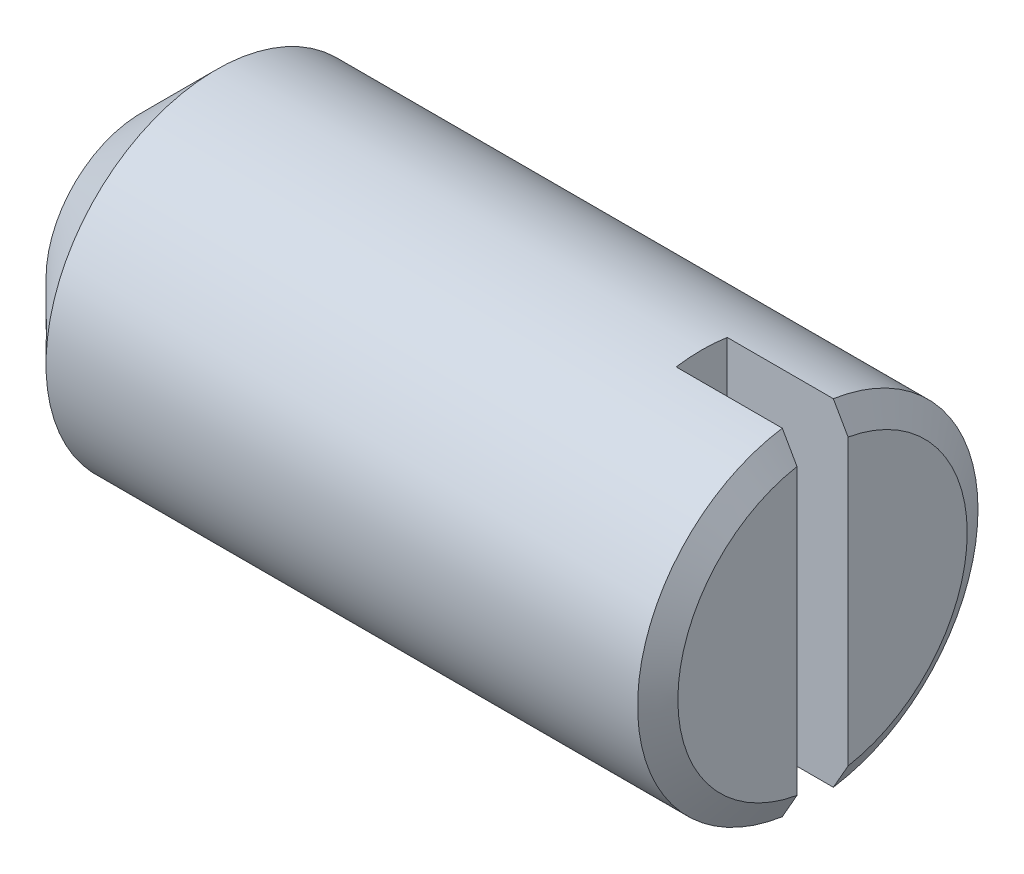
from build123d import *

# Parameters (mm, degrees)
SKICA2_W                 = 0.6
SKICA2_H                 = 4
ODEBRAT_VYSUNUT_M1_DEPTH = 1.42


with BuildPart() as part:
    # Skica1 → Otočit kolem osy1 (revolve)
    with BuildSketch(Plane(origin=(0, 0, 0), x_dir=(1, 0, 0), z_dir=(0, 1, 0))):
        Polygon((0, 0), (0, 1.125), (0.875, 2), (7.826794919, 2), (8, 1.7), (8, 0), align=None)
    revolve(axis=Axis((8, 0, 0), (-1, 0, 0)))

    # Skica2 → Odebrat vysunutím1 (cut)
    with BuildSketch(Plane(origin=(8, 0, 0), x_dir=(0, 0, -1), z_dir=(1, 0, 0))):
        Rectangle(SKICA2_W, SKICA2_H)
    extrude(amount=-ODEBRAT_VYSUNUT_M1_DEPTH, mode=Mode.SUBTRACT)


solid = part.part
